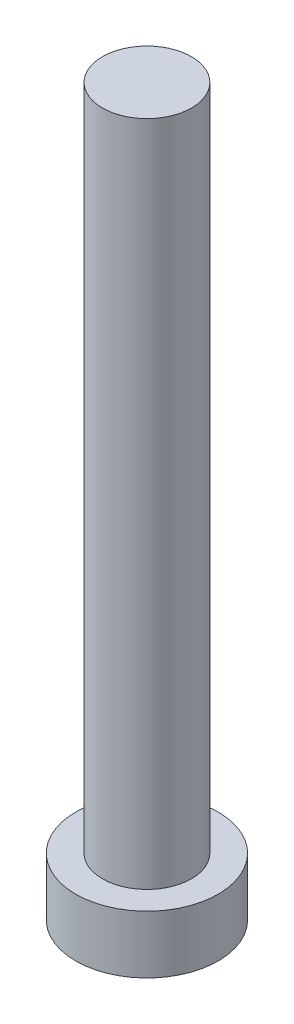
from build123d import *

# Parameters (mm, degrees)
SKETCH_1_R      = 1.6
EXTRUDE_1_DEPTH = 1.3
EXTRUDE_START   = 1.3
SKETCH_2_R      = 1
EXTRUDE_2_DEPTH = 15


with BuildPart() as part:
    # 草图1 → 凸台-拉伸1 (new body)
    with BuildSketch(Plane(origin=(0, 0, 0), x_dir=(1, 0, 0), z_dir=(0, 1, 0))):
        with Locations(Location((0, 0, 0), (0, 0, 270))):
            Circle(SKETCH_1_R)
    extrude(amount=EXTRUDE_1_DEPTH)

    # 草图2 → 凸台-拉伸2 (add)
    with BuildSketch(Plane(origin=(0, 0, 0), x_dir=(1, 0, 0), z_dir=(0, 1, 0)).offset(EXTRUDE_START)):
        with Locations(Location((0, 0, 0), (0, 0, 270))):
            Circle(SKETCH_2_R)
    extrude(amount=EXTRUDE_2_DEPTH)


solid = part.part
